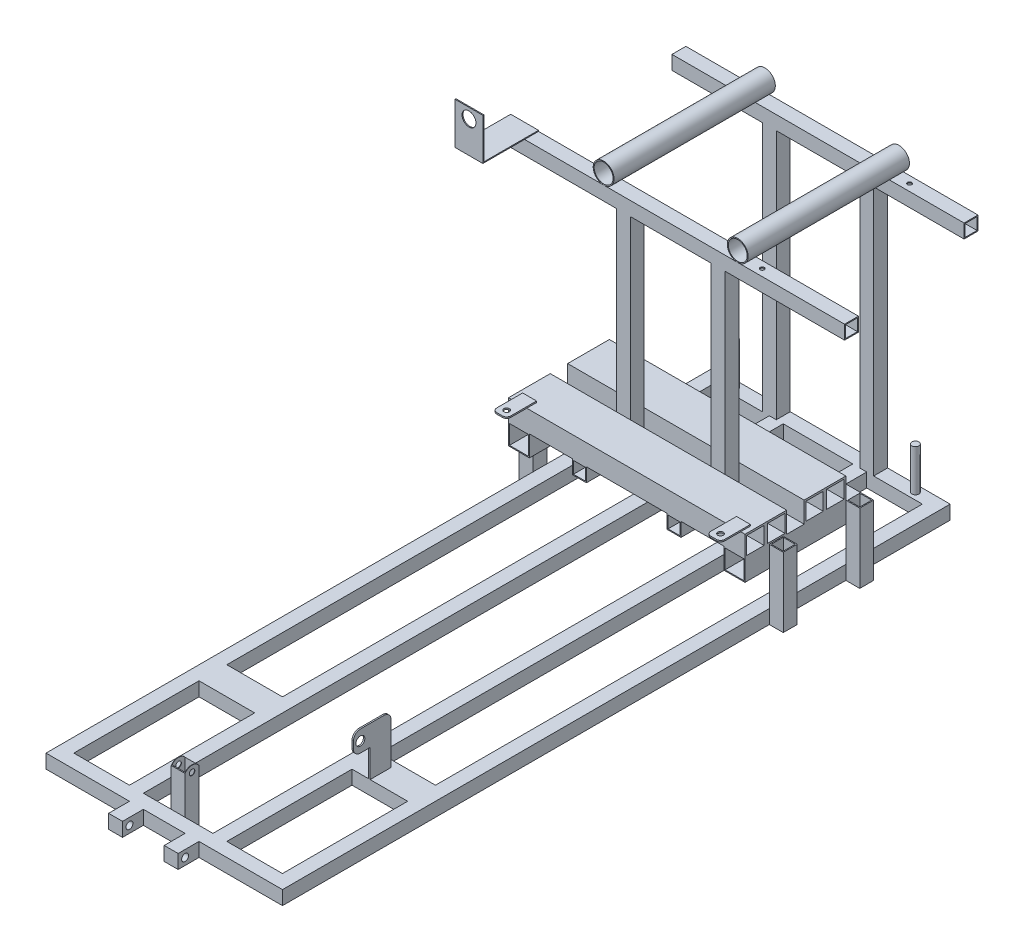
from build123d import *

# Parameters (mm, degrees)
SKETCH1_W                  = 170
SKETCH1_H                  = 480
SKETCH1_W_2                = 150
SKETCH1_H_2                = 460
SKETCH1_W_3                = 40
SKETCH1_H_3                = 20
SKETCH1_W_4                = 10
SKETCH1_H_4                = 15
BOSS_EXTRUDE1_DEPTH        = 10
SKETCH2_R                  = 2.5
CUT_EXTRUDE1_DEPTH         = 57
SKETCH3_R                  = 2.5
BOSS_EXTRUDE2_DEPTH        = 30
SKETCH4_W                  = 10
SKETCH4_H                  = 10
BOSS_EXTRUDE3_DEPTH        = 180
SKETCH5_W                  = 10
SKETCH5_H                  = 10
SKETCH5_W_2                = 8.6
SKETCH5_H_2                = 8.6
BOSS_EXTRUDE5_DEPTH        = 105
BOSS_EXTRUDE6_DEPTH        = 40
BOSS_EXTRUDE6_DEPTH_BACK   = 10
SKETCH6_W                  = 10
SKETCH6_H                  = 10
SKETCH6_W_2                = 8.6
SKETCH6_H_2                = 8.6
BOSS_EXTRUDE6_2_DEPTH      = 40
BOSS_EXTRUDE6_2_DEPTH_BACK = 10
SKETCH7_W                  = 15
SKETCH7_H                  = 15
SKETCH7_W_2                = 13.6
SKETCH7_H_2                = 13.6
BOSS_EXTRUDE7_DEPTH        = 82.5
BOSS_EXTRUDE8_START        = -170
SKETCH8_W                  = 15
SKETCH8_H                  = 15
SKETCH8_W_2                = 12.5
SKETCH8_H_2                = 12.5
BOSS_EXTRUDE8_DEPTH        = 170
SKETCH10_W                 = 10
SKETCH10_H                 = 10
SKETCH10_W_2               = 8.6
SKETCH10_H_2               = 8.6
BOSS_EXTRUDE9_DEPTH        = 140
BOSS_EXTRUDE9_2_DEPTH      = 140
SKETCH12_W                 = 10
SKETCH12_H                 = 10
SKETCH12_W_2               = 8.6
SKETCH12_H_2               = 8.6
BOSS_EXTRUDE10_DEPTH       = 125
BOSS_EXTRUDE11_START       = -72.5
SKETCH13_W                 = 10
SKETCH13_H                 = 10
SKETCH13_W_2               = 8.6
SKETCH13_H_2               = 8.6
BOSS_EXTRUDE11_DEPTH       = 72.5
SKETCH14_R                 = 7.5
SKETCH14_R_2               = 6.8
BOSS_EXTRUDE12_DEPTH       = 115.934012
BOSS_EXTRUDE12_2_DEPTH     = 115.934012
BOSS_EXTRUDE13_DEPTH       = 20
SKETCH16_R                 = 5
CUT_EXTRUDE2_DEPTH         = 20
SKETCH17_R                 = 1.5
CUT_EXTRUDE3_DEPTH         = 20
SKETCH20_R                 = 2
BOSS_EXTRUDE15_DEPTH       = 1
SKETCH18_W                 = 1
SKETCH18_H                 = 15
BOSS_EXTRUDE19_DEPTH       = 35
SKETCH26_W                 = 1
SKETCH26_H                 = 15
BOSS_EXTRUDE20_DEPTH       = 12
FILLET2_R                  = 5
SKETCH27_R                 = 3.198377389
CUT_EXTRUDE5_DEPTH         = 12
BOSS_EXTRUDE21_DEPTH       = 30
BOSS_EXTRUDE21_DEPTH_BACK  = 10
SKETCH28_W                 = 10
SKETCH28_H                 = 10
SKETCH28_W_2               = 9.4
SKETCH28_H_2               = 9.4
CUT_EXTRUDE6_DEPTH         = 30
SKETCH30_R                 = 2
CUT_EXTRUDE7_DEPTH         = 30


with BuildPart() as part:
    # Sketch1 → Boss-Extrude1 (new body)
    # profile 1 of 7: a face of its own
    with BuildSketch(Plane(origin=(0, 0, 0), x_dir=(1, 0, 0), z_dir=(0, 1, 0))):
        Rectangle(SKETCH1_W, SKETCH1_H)
        Rectangle(SKETCH1_W_2, SKETCH1_H_2, mode=Mode.SUBTRACT)
    # profile 2 of 7: a face of its own
    with BuildSketch(Plane(origin=(0, 0, 0), x_dir=(1, 0, 0), z_dir=(0, 1, 0))):
        Polygon((-25, 230), (-35, 230), (-35, -120), (-35, -140), (-35, -230), (-25, -230), align=None)
    # profile 3 of 7: a face of its own
    with BuildSketch(Plane(origin=(0, 0, 0), x_dir=(1, 0, 0), z_dir=(0, 1, 0))):
        Polygon((35, 230), (25, 230), (25, -230), (35, -230), (35, -140), (35, -120), align=None)
    # profile 4 of 7: a face of its own
    with BuildSketch(Plane(origin=(0, 0, 0), x_dir=(1, 0, 0), z_dir=(0, 1, 0))):
        with Locations((55, -130)):
            Rectangle(SKETCH1_W_3, SKETCH1_H_3)
    # profile 5 of 7: a face of its own
    with BuildSketch(Plane(origin=(0, 0, 0), x_dir=(1, 0, 0), z_dir=(0, 1, 0))):
        with Locations((-55, -130)):
            Rectangle(SKETCH1_W_3, SKETCH1_H_3)
    # profile 6 of 7: a face of its own
    with BuildSketch(Plane(origin=(0, 0, 0), x_dir=(1, 0, 0), z_dir=(0, 1, 0))):
        with Locations((-20, -247.5)):
            Rectangle(SKETCH1_W_4, SKETCH1_H_4)
    # profile 7 of 7: a face of its own
    with BuildSketch(Plane(origin=(0, 0, 0), x_dir=(1, 0, 0), z_dir=(0, 1, 0))):
        with Locations((20, -247.5)):
            Rectangle(SKETCH1_W_4, SKETCH1_H_4)
    extrude(amount=BOSS_EXTRUDE1_DEPTH)

    # Sketch2 → Cut-Extrude1 (cut)
    with BuildSketch(Plane(origin=(25, 0, 0), x_dir=(0, 0, -1), z_dir=(1, 0, 0))):
        with Locations((-250, 5)):
            Circle(SKETCH2_R)
    extrude(amount=-CUT_EXTRUDE1_DEPTH, mode=Mode.SUBTRACT)

    # Sketch3 → Boss-Extrude2 (add)
    with BuildSketch(Plane(origin=(0, 10, 0), x_dir=(1, 0, 0), z_dir=(0, 1, 0))):
        with Locations(Location((65, 235, 0), (0, 0, 270))):
            Circle(SKETCH3_R)
        with Locations(Location((-65, 235, 0), (0, 0, 90))):
            Circle(SKETCH3_R)
    extrude(amount=BOSS_EXTRUDE2_DEPTH)

    # Sketch4 → Boss-Extrude3 (add)
    with BuildSketch(Plane(origin=(0, 10, 0), x_dir=(1, 0, 0), z_dir=(0, 1, 0))):
        with Locations((35, 235)):
            Rectangle(SKETCH4_W, SKETCH4_H)
        with Locations((-35, 235)):
            Rectangle(SKETCH4_W, SKETCH4_H)
    extrude(amount=BOSS_EXTRUDE3_DEPTH)

    # Sketch5 → Boss-Extrude5 (add, symmetric)
    with BuildSketch(Plane(origin=(0, 0, 0), x_dir=(0, 0, -1), z_dir=(1, 0, 0))):
        with Locations((235, 195)):
            Rectangle(SKETCH5_W, SKETCH5_H)
        with Locations((235, 195)):
            Rectangle(SKETCH5_W_2, SKETCH5_H_2, mode=Mode.SUBTRACT)
    extrude(amount=BOSS_EXTRUDE5_DEPTH, both=True)


with BuildPart() as body_2:
    # Sketch6 → Boss-Extrude6 (new, two sides: drawn at the far end of the back side and taken through both)
    with BuildSketch(Plane(origin=(0, 10, 0), x_dir=(1, 0, 0), z_dir=(0, 1, 0)).offset(-BOSS_EXTRUDE6_DEPTH_BACK)):
        with Locations((-90, 170)):
            Rectangle(SKETCH6_W, SKETCH6_H)
        with Locations((-90, 170)):
            Rectangle(SKETCH6_W_2, SKETCH6_H_2, mode=Mode.SUBTRACT)
    extrude(amount=BOSS_EXTRUDE6_DEPTH + BOSS_EXTRUDE6_DEPTH_BACK)



with BuildPart() as body_3:
    # Sketch6 → Boss-Extrude6 2 (new, two sides: drawn at the far end of the back side and taken through both)
    with BuildSketch(Plane(origin=(0, 10, 0), x_dir=(1, 0, 0), z_dir=(0, 1, 0)).offset(-BOSS_EXTRUDE6_2_DEPTH_BACK)):
        with Locations((-90, 115)):
            Rectangle(SKETCH6_W, SKETCH6_H)
        with Locations((-90, 115)):
            Rectangle(SKETCH6_W_2, SKETCH6_H_2, mode=Mode.SUBTRACT)
    extrude(amount=BOSS_EXTRUDE6_2_DEPTH + BOSS_EXTRUDE6_2_DEPTH_BACK)


with BuildPart() as body_2_1:
    add(body_2.part)

    add(body_3.part)  # Boss-Extrude7 merges body 3
    # Sketch7 → Boss-Extrude7 (add)
    with BuildSketch(Plane(origin=(0, 0, -175), x_dir=(-1, 0, 0), z_dir=(0, 0, -1))):
        with Locations((77.5, 42.5)):
            Rectangle(SKETCH7_W, SKETCH7_H)
        with Locations((77.5, 42.5)):
            Rectangle(SKETCH7_W_2, SKETCH7_H_2, mode=Mode.SUBTRACT)
    extrude(amount=-BOSS_EXTRUDE7_DEPTH)


with BuildPart() as body_3_2:
    # Mirror1: mirrored copy
    add(body_2_1.part.mirror(Plane(origin=(0, 0, 0), x_dir=(0, 0, 1), z_dir=(1, 0, 0))))


with BuildPart() as body_2_2:
    add(body_2_1.part)

    add(body_3_2.part)  # Boss-Extrude8 merges body 3 2
    # Sketch8 → Boss-Extrude8 (add)
    # profile 1 of 4: a face of its own
    with BuildSketch(Plane.ZY.offset(85).offset(BOSS_EXTRUDE8_START)):
        with Locations((-157.5, 57.5)):
            Rectangle(SKETCH8_W, SKETCH8_H)
        with Locations((-157.5, 57.406606916)):
            Rectangle(SKETCH8_W_2, SKETCH8_H_2, mode=Mode.SUBTRACT)
    # profile 2 of 4: a face of its own
    with BuildSketch(Plane.ZY.offset(85).offset(BOSS_EXTRUDE8_START)):
        with Locations((-142.5, 57.5)):
            Rectangle(SKETCH8_W, SKETCH8_H)
        with Locations((-142.5, 57.406606916)):
            Rectangle(SKETCH8_W_2, SKETCH8_H_2, mode=Mode.SUBTRACT)
    # profile 3 of 4: a face of its own
    with BuildSketch(Plane.ZY.offset(85).offset(BOSS_EXTRUDE8_START)):
        Polygon((-122.5, 65), (-122.5, 50), (-120, 50), (-107.5, 50), (-107.5, 65), align=None)
        with Locations((-115, 57.406606916)):
            Rectangle(SKETCH8_W_2, SKETCH8_H_2, mode=Mode.SUBTRACT)
    # profile 4 of 4: a face of its own
    with BuildSketch(Plane.ZY.offset(85).offset(BOSS_EXTRUDE8_START)):
        with Locations((-100, 57.5)):
            Rectangle(SKETCH8_W, SKETCH8_H)
        with Locations((-100, 57.406606916)):
            Rectangle(SKETCH8_W_2, SKETCH8_H_2, mode=Mode.SUBTRACT)
    extrude(amount=BOSS_EXTRUDE8_DEPTH)



with BuildPart() as body_3_3:
    # Sketch10 → Boss-Extrude9 (new body)
    with BuildSketch(Plane(origin=(0, 50, 0), x_dir=(-1, 0, 0), z_dir=(0, -1, 0))):
        with Locations((34, 129.06598796)):
            Rectangle(SKETCH10_W, SKETCH10_H)
        with Locations((34, 129.06598796)):
            Rectangle(SKETCH10_W_2, SKETCH10_H_2, mode=Mode.SUBTRACT)
    extrude(amount=-BOSS_EXTRUDE9_DEPTH)



with BuildPart() as body_4:
    # Sketch10 → Boss-Extrude9 2 (new body)
    with BuildSketch(Plane(origin=(0, 50, 0), x_dir=(-1, 0, 0), z_dir=(0, -1, 0))):
        with Locations((-34, 129.06598796)):
            Rectangle(SKETCH10_W, SKETCH10_H)
        with Locations((-34, 129.06598796)):
            Rectangle(SKETCH10_W_2, SKETCH10_H_2, mode=Mode.SUBTRACT)
    extrude(amount=-BOSS_EXTRUDE9_2_DEPTH)


with BuildPart() as body_3_3_1:
    add(body_3_3.part)

    add(body_4.part)  # Boss-Extrude10 merges body 4
    # Sketch12 → Boss-Extrude10 (add, symmetric)
    with BuildSketch(Plane(origin=(0, 0, 0), x_dir=(0, 0, -1), z_dir=(1, 0, 0))):
        with Locations((129.06598796, 195)):
            Rectangle(SKETCH12_W, SKETCH12_H)
        with Locations((129.06598796, 195)):
            Rectangle(SKETCH12_W_2, SKETCH12_H_2, mode=Mode.SUBTRACT)
    extrude(amount=BOSS_EXTRUDE10_DEPTH, both=True)


with BuildPart() as body_2_3:
    add(body_2_2.part)

    add(body_3_3_1.part)  # Boss-Extrude11 merges body 3 3
    # Sketch13 → Boss-Extrude11 (add)
    # profile 1 of 2: a face of its own
    with BuildSketch(Plane(origin=(0, 0, -165), x_dir=(-1, 0, 0), z_dir=(0, 0, -1)).offset(BOSS_EXTRUDE11_START)):
        with Locations((-34, 45)):
            Rectangle(SKETCH13_W, SKETCH13_H)
        with Locations((-34, 45)):
            Rectangle(SKETCH13_W_2, SKETCH13_H_2, mode=Mode.SUBTRACT)
    # profile 2 of 2: a face of its own
    with BuildSketch(Plane(origin=(0, 0, -165), x_dir=(-1, 0, 0), z_dir=(0, 0, -1)).offset(BOSS_EXTRUDE11_START)):
        with Locations((34, 45)):
            Rectangle(SKETCH13_W, SKETCH13_H)
        with Locations((34, 45)):
            Rectangle(SKETCH13_W_2, SKETCH13_H_2, mode=Mode.SUBTRACT)
    extrude(amount=BOSS_EXTRUDE11_DEPTH)

    # Sketch15 → Boss-Extrude13 (add)
    with BuildSketch(Plane.ZY.offset(125)):
        Polygon((-134.06598796, 200), (-94.06598796, 200), (-94.06598796, 230), (-94.76598796, 230), (-94.76598796, 200.7), (-134.06598796, 200.7), align=None)
    extrude(amount=-BOSS_EXTRUDE13_DEPTH)

    # Sketch16 → Cut-Extrude2 (cut)
    with BuildSketch(Plane.XY.offset(-94.06598796)):
        with Locations((-115, 222.730622408)):
            Circle(SKETCH16_R)
    extrude(amount=-CUT_EXTRUDE2_DEPTH, mode=Mode.SUBTRACT)


with BuildPart() as body_3_4:
    # Sketch14 → Boss-Extrude12 (new body)
    with BuildSketch(Plane(origin=(0, 0, -240), x_dir=(-1, 0, 0), z_dir=(0, 0, -1))):
        with Locations((48.197752972, 207.5)):
            Circle(SKETCH14_R)
        with Locations((48.197752972, 207.5)):
            Circle(SKETCH14_R_2, mode=Mode.SUBTRACT)
    extrude(amount=-BOSS_EXTRUDE12_DEPTH)


with BuildPart() as body_4_2:
    # Sketch14 → Boss-Extrude12 2 (new body)
    with BuildSketch(Plane(origin=(0, 0, -240), x_dir=(-1, 0, 0), z_dir=(0, 0, -1))):
        with Locations(Location((-48.197752972, 207.5, 0), (0, 0, 180))):
            Circle(SKETCH14_R)
        with Locations(Location((-48.197752972, 207.5, 0), (0, 0, 180))):
            Circle(SKETCH14_R_2, mode=Mode.SUBTRACT)
    extrude(amount=-BOSS_EXTRUDE12_2_DEPTH)


with BuildPart() as cut_extrude3_tool:
    # Sketch17 → Cut-Extrude3 (new body)
    with BuildSketch(Plane(origin=(0, 200, 0), x_dir=(1, 0, 0), z_dir=(0, 1, 0))):
        with Locations(Location((60.830977472, 235, 0), (0, 0, 270))):
            Circle(SKETCH17_R)
        with Locations(Location((60.830977472, 129.06598796, 0), (0, 0, 270))):
            Circle(SKETCH17_R)
    extrude(amount=-CUT_EXTRUDE3_DEPTH)


with BuildPart() as part_1:
    add(part.part)

    # Cut-Extrude3: cut by cut_extrude3_tool
    add(cut_extrude3_tool.part, mode=Mode.SUBTRACT)

    # Sketch18 → Boss-Extrude19 (add)
    with BuildSketch(Plane(origin=(0, 10, 0), x_dir=(1, 0, 0), z_dir=(0, 1, 0))):
        with Locations((47.5, -132.5)):
            Rectangle(SKETCH18_W, SKETCH18_H)
    extrude(amount=BOSS_EXTRUDE19_DEPTH)

    # Sketch26 → Boss-Extrude20 (add)
    with BuildSketch(Plane.XY.offset(140)):
        with Locations((47.5, 37.5)):
            Rectangle(SKETCH26_W, SKETCH26_H)
    extrude(amount=BOSS_EXTRUDE20_DEPTH)

    # Fillet2
    fillet2_edges = [part_1.edges().sort_by_distance(p)[0] for p in [
        (47.5, 45, 125),
        (47.5, 30, 152),
        (47.5, 45, 152),
    ]]
    fillet(fillet2_edges, radius=FILLET2_R)

    # Sketch27 → Cut-Extrude5 (cut)
    with BuildSketch(Plane.ZY.offset(-47)):
        with Locations((147, 37.5)):
            Circle(SKETCH27_R)
    extrude(amount=-CUT_EXTRUDE5_DEPTH, mode=Mode.SUBTRACT)

    # Sketch28 → Boss-Extrude21 (add, two sides: drawn at the far end of the back side and taken through both)
    with BuildSketch(Plane(origin=(0, 10, 0), x_dir=(1, 0, 0), z_dir=(0, 1, 0)).offset(-BOSS_EXTRUDE21_DEPTH_BACK)):
        with Locations((0, -225)):
            Rectangle(SKETCH28_W, SKETCH28_H)
        with Locations((0, -225)):
            Rectangle(SKETCH28_W_2, SKETCH28_H_2, mode=Mode.SUBTRACT)
    extrude(amount=BOSS_EXTRUDE21_DEPTH + BOSS_EXTRUDE21_DEPTH_BACK)

    # Sketch29 → Cut-Extrude6 (cut)
    with BuildSketch(Plane(origin=(5, 0, 0), x_dir=(0, 0, -1), z_dir=(1, 0, 0))):
        with BuildLine():
            Line((-225, 40), (-230, 40))
            Line((-230, 40), (-230, 37.297031928))
            ThreePointArc((-230, 37.297031928), (-227.841919967, 39.281005801), (-225, 40))
        make_face()
        with BuildLine():
            Line((-220, 40), (-225, 40))
            ThreePointArc((-225, 40), (-222.158080033, 39.281005801), (-220, 37.297031928))
            Line((-220, 37.297031928), (-220, 40))
        make_face()
    extrude(amount=-CUT_EXTRUDE6_DEPTH, mode=Mode.SUBTRACT)

    # Sketch30 → Cut-Extrude7 (cut)
    with BuildSketch(Plane(origin=(5, 0, 0), x_dir=(0, 0, -1), z_dir=(1, 0, 0))):
        with Locations((-225, 35.513066423)):
            Circle(SKETCH30_R)
    extrude(amount=-CUT_EXTRUDE7_DEPTH, mode=Mode.SUBTRACT)


with BuildPart() as body_2_4:
    add(body_2_3.part)

    # Cut-Extrude3: cut by cut_extrude3_tool
    add(cut_extrude3_tool.part, mode=Mode.SUBTRACT)

    # Sketch20 → Boss-Extrude15 (add)
    with BuildSketch(Plane(origin=(0, 65, 0), x_dir=(1, 0, 0), z_dir=(0, 1, 0))):
        with BuildLine():
            Line((81.884125384, 92.5), (81.884125384, 81))
            ThreePointArc((81.884125384, 81), (81.005445728, 78.878679656), (78.884125384, 78))
            Line((78.884125384, 78), (74.884125384, 78))
            ThreePointArc((74.884125384, 78), (72.76280504, 78.878679656), (71.884125384, 81))
            Line((71.884125384, 81), (71.884125384, 93))
            Line((71.884125384, 93), (71.884125384, 99.527353642))
            Line((71.884125384, 99.527353642), (81.884125384, 99.527353642))
            Line((81.884125384, 99.527353642), (81.884125384, 92.5))
        make_face()
        with Locations(Location((76.884125384, 83.063118127, 0), (0, 0, 270))):
            Circle(SKETCH20_R, mode=Mode.SUBTRACT)
    boss_extrude15 = extrude(amount=BOSS_EXTRUDE15_DEPTH)

    # Mirror2: Boss-Extrude15 across plane
    add(boss_extrude15.mirror(Plane(origin=(0, 0, 0), x_dir=(0, 0, 1), z_dir=(1, 0, 0))))


solid = Compound([body_3_4.part, body_4_2.part, part_1.part, body_2_4.part])
